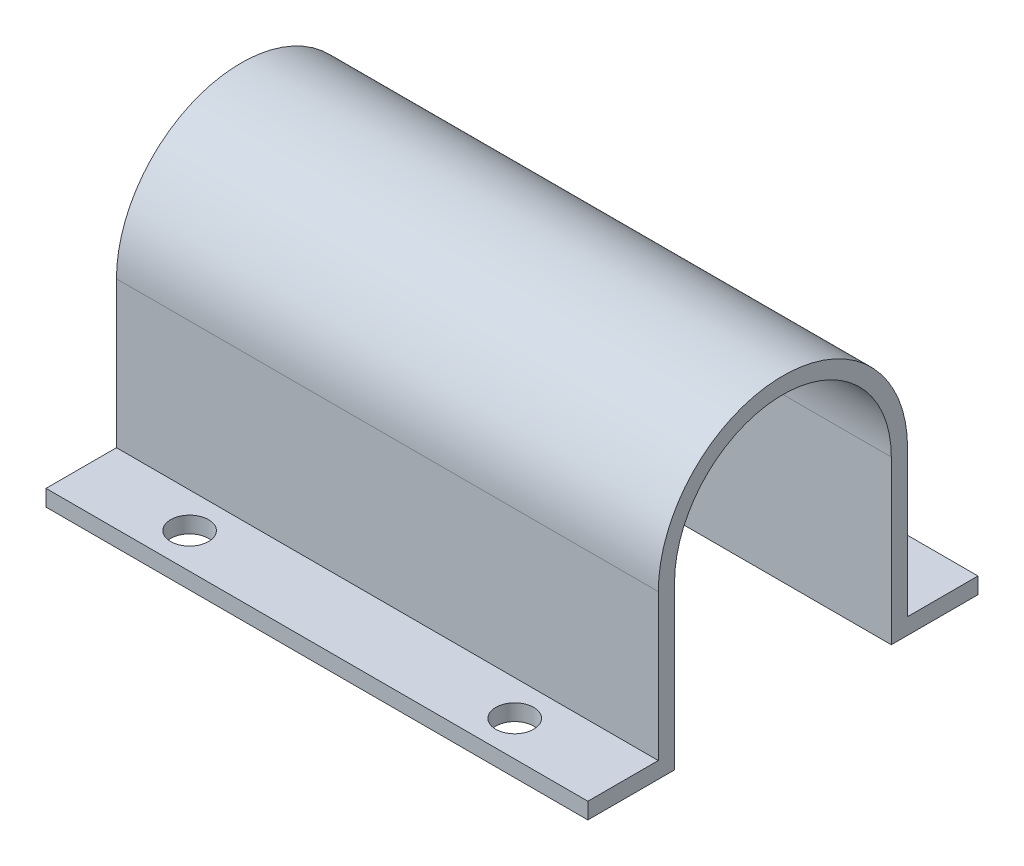
from build123d import *

# Parameters (mm, degrees)
BOSS_EXTRUDE1_DEPTH = 25
SKETCH2_R           = 1.75
CUT_EXTRUDE1_DEPTH  = 40.67366885


with BuildPart() as part:
    # Sketch1 → Boss-Extrude1 (new, symmetric)
    with BuildSketch(Plane(origin=(0, 0, 0), x_dir=(0, 0, -1), z_dir=(1, 0, 0))):
        with BuildLine():
            Line((-10, 15), (-10, 0))
            Line((-10, 0), (-18, 0))
            Line((-18, 0), (-18, 1.5))
            Line((-18, 1.5), (-11.5, 1.5))
            Line((-11.5, 1.5), (-11.5, 15))
            ThreePointArc((-11.5, 15), (0, 26.5), (11.5, 15))
            Line((11.5, 15), (11.5, 1.5))
            Line((11.5, 1.5), (18, 1.5))
            Line((18, 1.5), (18, 0))
            Line((18, 0), (10, 0))
            Line((10, 0), (10, 15))
            ThreePointArc((10, 15), (0, 25), (-10, 15))
        make_face()
    extrude(amount=BOSS_EXTRUDE1_DEPTH, both=True)

    # Sketch2 → Cut-Extrude1 (cut, through all)
    with BuildSketch(Plane(origin=(0, 1.5, 0), x_dir=(1, 0, 0), z_dir=(0, 1, 0))):
        with Locations(Location((-15, 14.75, 0), (0, 0, 270))):
            Circle(SKETCH2_R)
        with Locations(Location((-15, -14.75, 0), (0, 0, 270))):
            Circle(SKETCH2_R)
    cut_extrude1 = extrude(amount=-CUT_EXTRUDE1_DEPTH, mode=Mode.SUBTRACT)

    # Mirror1: Cut-Extrude1 across plane
    add(cut_extrude1.mirror(Plane(origin=(0, 0, 0), x_dir=(0, 0, 1), z_dir=(1, 0, 0))), mode=Mode.SUBTRACT)


solid = part.part
